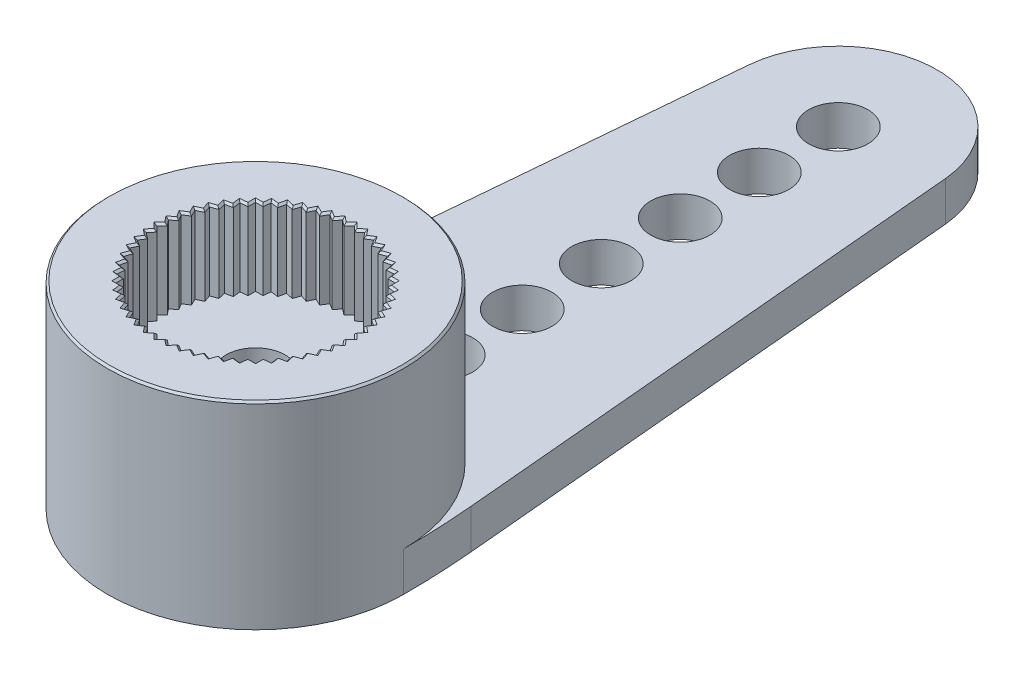
from build123d import *

# Parameters (mm, degrees)
SKETCH1_R           = 0.7500000000000002
SKETCH1_R_2         = 0.7500000000000003
SKETCH1_R_3         = 0.75
BOSS_EXTRUDE1_DEPTH = 1
SKETCH2_R           = 1.5
CUT_EXTRUDE1_DEPTH  = 1
SKETCH2_3_R         = 3.7499999999999964
BOSS_EXTRUDE2_DEPTH = 4
SKETCH1_2_R         = 0.75
CUT_EXTRUDE2_DEPTH  = 19.34734313190876
CUT_EXTRUDE3_START  = -2
SKETCH3_R           = 0.75
CUT_EXTRUDE3_DEPTH  = 2
CHAMFER1_SIZE       = 0.05
CUT_EXTRUDE6_START  = -10
SKETCH4_R           = 0.7500000000000002
SKETCH4_R_2         = 0.7500000000000003
CUT_EXTRUDE6_DEPTH  = 10


with BuildPart() as part:
    # Sketch1 → Boss-Extrude1 (new body)
    with BuildSketch(Plane(origin=(0, 0, 0), x_dir=(1, 0, 0), z_dir=(0, 1, 0))):
        with BuildLine():
            Line((-3.670399020511729, 1.7826112485887735), (-2.4900498775639615, 14.972826406073596))
            ThreePointArc((-2.4900498775639615, 14.972826406073596), (4.44e-15, 17.24999999999999), (2.4900498775639615, 14.972826406073596))
            Line((2.4900498775639615, 14.972826406073596), (3.670399020511729, 1.7826112485887735))
            ThreePointArc((3.670399020511729, 1.7826112485887735), (3.75, 0), (3.670399020511729, -1.7826112485887735))
            Line((3.670399020511729, -1.7826112485887735), (2.4900498775639615, -14.972826406073596))
            ThreePointArc((2.4900498775639615, -14.972826406073596), (4.44e-15, -17.24999999999999), (-2.4900498775639615, -14.972826406073596))
            Line((-2.4900498775639615, -14.972826406073596), (-3.670399020511729, -1.7826112485887735))
            ThreePointArc((-3.670399020511729, -1.7826112485887735), (-3.75, -2.45e-15), (-3.670399020511729, 1.7826112485887735))
        make_face()
        with Locations(Location((5.4e-15, 14.75, 0), (0, 0, 270))):
            Circle(SKETCH1_R, mode=Mode.SUBTRACT)
        with Locations(Location((2.635e-14, 12.75, 0), (0, 0, 270))):
            Circle(SKETCH1_R, mode=Mode.SUBTRACT)
        with Locations(Location((4.73e-14, 10.75, 0), (0, 0, 270))):
            Circle(SKETCH1_R, mode=Mode.SUBTRACT)
        with Locations(Location((6.825e-14, 8.749999999999998, 0), (0, 0, 270))):
            Circle(SKETCH1_R_2, mode=Mode.SUBTRACT)
        with Locations(Location((8.919e-14, 6.749999999999999, 0), (0, 0, 270))):
            Circle(SKETCH1_R, mode=Mode.SUBTRACT)
        with Locations(Location((1.1014e-13, 4.749999999999999, 0), (0, 0, 270))):
            Circle(SKETCH1_R, mode=Mode.SUBTRACT)
        with Locations(Location((-3.06e-15, 0, 0), (0, 0, 270))):
            Circle(SKETCH1_R_3, mode=Mode.SUBTRACT)
        with Locations(Location((1.1014e-13, -4.749999999999999, 0), (0, 0, 90))):
            Circle(SKETCH1_R, mode=Mode.SUBTRACT)
        with Locations(Location((8.919e-14, -6.749999999999999, 0), (0, 0, 90))):
            Circle(SKETCH1_R, mode=Mode.SUBTRACT)
        with Locations(Location((6.825e-14, -8.749999999999998, 0), (0, 0, 90))):
            Circle(SKETCH1_R_2, mode=Mode.SUBTRACT)
        with Locations(Location((4.73e-14, -10.75, 0), (0, 0, 90))):
            Circle(SKETCH1_R, mode=Mode.SUBTRACT)
        with Locations(Location((2.635e-14, -12.75, 0), (0, 0, 90))):
            Circle(SKETCH1_R, mode=Mode.SUBTRACT)
        with Locations(Location((5.4e-15, -14.75, 0), (0, 0, 90))):
            Circle(SKETCH1_R, mode=Mode.SUBTRACT)
    extrude(amount=BOSS_EXTRUDE1_DEPTH)

    # Sketch2 → Cut-Extrude1 (cut)
    with BuildSketch(Plane(origin=(0, 1, 0), x_dir=(1, 0, 0), z_dir=(0, 1, 0))):
        with Locations(Location((0, 0, 0), (0, 0, 270))):
            Circle(SKETCH2_R)
    extrude(amount=-CUT_EXTRUDE1_DEPTH, mode=Mode.SUBTRACT)

    # Sketch2<3> → Boss-Extrude2 (add)
    with BuildSketch(Plane(origin=(0, 1, 0), x_dir=(1, 0, 0), z_dir=(0, 1, 0))):
        with Locations(Location((0, 0, 0), (0, 0, 180))):
            Circle(SKETCH2_3_R)
    extrude(amount=BOSS_EXTRUDE2_DEPTH)

    # Sketch1<2> → Cut-Extrude2 (cut, through all)
    with BuildSketch(Plane(origin=(0, 0, 0), x_dir=(1, 0, 0), z_dir=(0, 1, 0))):
        with Locations(Location((-3.06e-15, 0, 0), (0, 0, 270))):
            Circle(SKETCH1_2_R)
    extrude(amount=CUT_EXTRUDE2_DEPTH, mode=Mode.SUBTRACT)

    # Sketch3 → Cut-Extrude3 (cut)
    with BuildSketch(Plane(origin=(0, 5, 0), x_dir=(1, 0, 0), z_dir=(0, 1, 0)).offset(CUT_EXTRUDE3_START)):
        Polygon((0.13293170414991673, 2.3670682958500833), (0, 2.5), (-0.1329317041499017, 2.3670682958500984), (-0.27991119025823724, 2.48428052473311), (-0.39712341914126226, 2.337301038624758), (-0.5563023348907544, 2.437319780454566), (-0.6563210767205921, 2.278140864705026), (-0.8256976548879083, 2.359708325770875), (-0.9072651159537664, 2.1903317476035395), (-1.0847093477938792, 2.2524221697559907), (-1.1467997699463375, 2.074977937915856), (-1.3300801912883173, 2.11681049807064), (-1.3719127514431064, 1.9335300767286385), (-1.5587245046468003, 1.9545787061699929), (-1.579773134088157, 1.7677669529662765), (-1.7677669529663247, 1.7677669529662765), (-1.7677669529663245, 1.5797731340880863), (-1.9545787061700186, 1.5587245046467322), (-1.9335300767286616, 1.3719127514430158), (-2.1168104980706417, 1.330080191288232), (-2.0749779379158526, 1.14679976994623), (-2.252422169755966, 1.084709347793779), (-2.190331747603507, 0.9072651159536451), (-2.3597083257708227, 0.8256976548877967), (-2.278140864704964, 0.6563210767204612), (-2.4373197804544473, 0.5563023348906617), (-2.337301038624636, 0.39712341914115934), (-2.4842805247329802, 0.2799111902581436), (-2.3670682958499505, 0.1329317041497819), (-2.499999999999859, -1.2601e-13), (-2.367068295849935, -0.1329317041500497), (-2.4842805247329505, -0.27991119025839395), (-2.3373010386245885, -0.3971234191414236), (-2.4373197804543887, -0.556302334890907), (-2.2781408647048855, -0.6563210767207186), (-2.359708325770734, -0.8256976548880337), (-2.1903317476033988, -0.9072651159538916), (-2.2524221697558495, -1.0847093477940046), (-2.0749779379157154, -1.1467997699464625), (-2.1168104980704996, -1.3300801912884428), (-1.9335300767284973, -1.3719127514432319), (-1.954578706169852, -1.5587245046469258), (-1.7677669529661355, -1.5797731340882826), (-1.7677669529661355, -1.7677669529664501), (-1.579773134087945, -1.76776695296645), (-1.558724504646591, -1.9545787061701443), (-1.3719127514428746, -1.933530076728787), (-1.3300801912880909, -2.116810498070767), (-1.1467997699460888, -2.0749779379159774), (-1.0847093477936383, -2.2524221697560907), (-0.9072651159535039, -2.1903317476036324), (-0.8256976548876556, -2.359708325770948), (-0.6563210767203201, -2.2781408647050894), (-0.5563023348905206, -2.4373197804545734), (-0.3971234191410181, -2.3373010386247617), (-0.2799111902580026, -2.484280524733106), (-0.13293170414964117, -2.367068295850076), (2.6702e-13, -2.4999999999999845), (0.13293170415019073, -2.3670682958500606), (0.27991119025853495, -2.484280524733076), (0.3971234191415647, -2.337301038624714), (0.5563023348910479, -2.437319780454514), (0.6563210767208596, -2.2781408647050108), (0.8256976548881746, -2.3597083257708595), (0.9072651159540329, -2.190331747603524), (1.0847093477941459, -2.2524221697559748), (1.1467997699466042, -2.074977937915841), (1.330080191288584, -2.116810498070625), (1.371912751443373, -1.9335300767286228), (1.5587245046470666, -1.9545787061699773), (1.5797731340884236, -1.767766952966261), (1.7677669529665911, -1.767766952966261), (1.767766952966591, -1.5797731340880707), (1.9545787061702853, -1.5587245046467169), (1.9335300767289283, -1.3719127514430003), (2.1168104980709086, -1.3300801912882163), (2.074977937916119, -1.1467997699462147), (2.252422169756232, -1.0847093477937637), (2.190331747603773, -0.9072651159536298), (2.3597083257710887, -0.8256976548877811), (2.2781408647052306, -0.6563210767204459), (2.437319780454714, -0.5563023348906463), (2.337301038624903, -0.39712341914114396), (2.484280524733247, -0.2799111902581283), (2.3670682958502174, -0.13293170414976638), (2.5000000000001252, 1.4132e-13), (2.3670682958502014, 0.132931704150065), (2.484280524733217, 0.2799111902584092), (2.3373010386248554, 0.39712341914143867), (2.437319780454655, 0.5563023348909222), (2.2781408647051524, 0.6563210767207336), (2.3597083257710008, 0.825697654888049), (2.1903317476036657, 0.907265115953907), (2.2524221697561164, 1.08470934779402), (2.074977937915982, 1.146799769946478), (2.1168104980707665, 1.3300801912884581), (1.9335300767287644, 1.371912751443247), (1.9545787061701188, 1.5587245046469411), (1.7677669529664024, 1.579773134088298), (1.7677669529664026, 1.7677669529664655), (1.5797731340882124, 1.7677669529664655), (1.5587245046468583, 1.9545787061701598), (1.3719127514431417, 1.9335300767288028), (1.3300801912883577, 2.116810498070783), (1.146799769946356, 2.074977937915993), (1.0847093477939052, 2.252422169756106), (0.9072651159537498, 2.1903317476036404), (0.8256976548879196, 2.359708325770918), (0.6563210767205938, 2.278140864705065), (0.5563023348907874, 2.437319780454559), (0.3971234191412931, 2.3373010386247532), (0.2799111902582702, 2.4842805247331063), align=None)
        Circle(SKETCH3_R, mode=Mode.SUBTRACT)
    extrude(amount=CUT_EXTRUDE3_DEPTH, mode=Mode.SUBTRACT)

    # Chamfer1
    chamfer1_edges = [part.edges().sort_by_distance(p)[0] for p in [
        (-0.20642144720406946, 5, -2.425674410291604),
        (0.06646585207495836, 5, -2.433534147925042),
        (0.3385173046997816, 5, -2.41079078167893),
        (0.6063117058056906, 5, -2.357730322579812),
        (0.8664813854208349, 5, -2.2750200366872795),
        (1.1157545588701305, 5, -2.16370005383605),
        (1.3509964713657499, 5, -2.025170287399793),
        (1.5692488193675354, 5, -1.8611728295683125),
        (1.7677669529664026, 5, -1.6737700435273817),
        (1.9440543914494417, 5, -1.465318628045094),
        (2.095894217993374, 5, -1.2384399806174682),
        (2.2213769586798913, 5, -0.9959872318739635),
        (2.3189245952380766, 5, -0.7410093658043913),
        (2.3873104095397553, 5, -0.4767128770161805),
        (2.425674410291709, 5, -0.20642144720423716),
        (2.4335341479251715, 5, 0.06646585207481252),
        (2.410790781679075, 5, 0.3385173046996361),
        (2.3577303225799726, 5, 0.606311705805546),
        (2.275020036687431, 5, 0.8664813854207054),
        (2.1637000538361755, 5, 1.1157545588699893),
        (2.0251702873999182, 5, 1.3509964713656082),
        (1.8611728295684382, 5, 1.569248819367394),
        (1.6737700435275074, 5, 1.767766952966261),
        (1.4653186280452197, 5, 1.9440543914493),
        (1.2384399806175943, 5, 2.0958942179932327),
        (0.9959872318740894, 5, 2.2213769586797496),
        (0.741009365804517, 5, 2.3189245952379354),
        (0.47671287701630627, 5, 2.387310409539614),
        (0.2064214472043629, 5, 2.4256744102915686),
        (-0.06646585207468704, 5, 2.4335341479250303),
        (-0.33851730469951036, 5, 2.4107907816789336),
        (-0.6063117058054205, 5, 2.3577303225798314),
        (-0.8664813854205797, 5, 2.27502003668729),
        (-1.1157545588698636, 5, 2.163700053836034),
        (-1.3509964713654827, 5, 2.025170287399777),
        (-1.569248819367268, 5, 1.861172829568297),
        (-1.7677669529661355, 5, 1.6737700435273664),
        (-1.9440543914491748, 5, 1.465318628045079),
        (-2.0958942179931075, 5, 1.2384399806174526),
        (-2.2213769586796244, 5, 0.9959872318739482),
        (-2.3189245952378097, 5, 0.7410093658043762),
        (-2.387310409539489, 5, 0.47671287701616527),
        (-2.4256744102914425, 5, 0.20642144720422184),
        (-2.4335341479249046, 5, -0.06646585207482801),
        (-2.4107907816788083, 5, -0.33851730469965136),
        (-2.3577303225797057, 5, -0.6063117058055616),
        (-2.275020036687165, 5, -0.866481385420721),
        (-2.1637000538359095, 5, -1.1157545588700044),
        (-2.0251702873996518, 5, -1.350996471365624),
        (-1.8611728295681715, 5, -1.5692488193674092),
        (-1.6737700435272407, 5, -1.7677669529662765),
        (-1.4653186280449533, 5, -1.9440543914493156),
        (-1.2384399806173274, 5, -2.095894217993248),
        (-0.9959872318738228, 5, -2.221376958679765),
        (-0.74100936580425, 5, -2.3189245952379505),
        (-0.47671287701600834, 5, -2.387310409539662),
        (-0.3385173046997497, 5, -2.410790781678934),
        (-0.6063117058056733, 5, -2.357730322579796),
        (-0.8664813854208373, 5, -2.2750200366872075),
        (-1.1157545588701083, 5, -2.1637000538359237),
        (-1.3509964713657119, 5, -2.0251702873996393),
        (-1.5692488193674787, 5, -1.8611728295681347),
        (-1.7677669529663245, 5, -1.6737700435271814),
        (-1.94405439144934, 5, -1.465318628044874),
        (-2.095894217993247, 5, -1.238439980617231),
        (-2.2213769586797367, 5, -0.9959872318737121),
        (-2.3189245952378936, 5, -0.741009365804129),
        (-2.3873104095395417, 5, -0.47671287701591053),
        (-2.4256744102914656, 5, -0.20642144720396274),
        (-2.433534147924897, 5, 0.06646585207508786),
        (-2.4107907816787693, 5, 0.33851730469990876),
        (-2.357730322579637, 5, 0.6063117058058127),
        (-2.2750200366870663, 5, 0.8664813854209626),
        (-2.1637000538357825, 5, 1.1157545588702336),
        (-2.0251702873994986, 5, 1.3509964713658373),
        (-1.8611728295679937, 5, 1.5692488193676042),
        (-1.6737700435270404, 5, 1.7677669529664501),
        (-1.4653186280447328, 5, 1.9440543914494657),
        (-1.2384399806170898, 5, 2.095894217993372),
        (-0.9959872318735711, 5, 2.2213769586798615),
        (-0.7410093658039878, 5, 2.318924595238019),
        (-0.47671287701576937, 5, 2.3873104095396678),
        (-0.20642144720382188, 5, 2.425674410291591),
        (0.06646585207522888, 5, 2.4335341479250223),
        (0.3385173047000498, 5, 2.4107907816788954),
        (0.6063117058059537, 5, 2.357730322579762),
        (0.8664813854211038, 5, 2.2750200366871915),
        (1.115754558870375, 5, 2.1637000538359077),
        (1.3509964713659786, 5, 2.025170287399624),
        (1.5692488193677452, 5, 1.8611728295681191),
        (1.767766952966591, 5, 1.6737700435271659),
        (1.944054391449607, 5, 1.4653186280448587),
        (2.095894217993514, 5, 1.2384399806172155),
        (2.2213769586800023, 5, 0.9959872318736968),
        (2.3189245952381596, 5, 0.7410093658041135),
        (2.3873104095398086, 5, 0.47671287701589515),
        (2.4256744102917325, 5, 0.20642144720394734),
        (2.4335341479251635, 5, -0.06646585207510317),
        (2.410790781679036, 5, -0.3385173046999239),
        (2.357730322579904, 5, -0.6063117058058278),
        (2.275020036687333, 5, -0.8664813854209781),
        (2.163700053836049, 5, -1.115754558870249),
        (2.0251702873997655, 5, -1.3509964713658524),
        (1.8611728295682606, 5, -1.5692488193676195),
        (1.6737700435273075, 5, -1.7677669529664655),
        (1.465318628045, 5, -1.9440543914494812),
        (1.2384399806173567, 5, -2.095894217993388),
        (0.9959872318738274, 5, -2.221376958679873),
        (0.7410093658042567, 5, -2.3189245952379913),
        (0.47671287701604026, 5, -2.3873104095396562),
        (0.2064214472040934, 5, -2.425674410291595),
        (-0.06646585207495086, 5, -2.433534147925049),
        (3.7499999999999964, 5, 9.2e-16),
    ]]
    chamfer(chamfer1_edges, length=CHAMFER1_SIZE)

    # Sketch4 → Cut-Extrude6 (cut)
    with BuildSketch(Plane(origin=(0, 1, 0), x_dir=(1, 0, 0), z_dir=(0, 1, 0)).offset(CUT_EXTRUDE6_START)):
        with BuildLine():
            ThreePointArc((3.670399020511729, -1.7826112485887735), (3.7300898447709017, -0.8921938101571203), (3.7499999999999964, 0))
            ThreePointArc((3.7499999999999964, 0), (2.3e-16, -3.7499999999999964), (-3.7499999999999964, 0))
            ThreePointArc((-3.7499999999999964, 0), (-3.730089844770898, -0.8921938101571197), (-3.670399020511729, -1.7826112485887813))
            Line((-3.670399020511729, -1.7826112485887813), (-2.4900498775639615, -14.972826406073596))
            ThreePointArc((-2.4900498775639615, -14.972826406073596), (5e-15, -17.25), (2.490049877563967, -14.972826406073596))
            Line((2.490049877563967, -14.972826406073596), (3.670399020511729, -1.7826112485887735))
        make_face()
        with Locations((2.635e-14, -12.75)):
            Circle(SKETCH4_R, mode=Mode.SUBTRACT)
        with Locations((1.1014e-13, -4.749999999999999)):
            Circle(SKETCH4_R, mode=Mode.SUBTRACT)
        with Locations((4.73e-14, -10.75)):
            Circle(SKETCH4_R, mode=Mode.SUBTRACT)
        with Locations((5.4e-15, -14.75)):
            Circle(SKETCH4_R, mode=Mode.SUBTRACT)
        with Locations((8.919e-14, -6.749999999999999)):
            Circle(SKETCH4_R, mode=Mode.SUBTRACT)
        with Locations((6.825e-14, -8.749999999999998)):
            Circle(SKETCH4_R_2, mode=Mode.SUBTRACT)
    extrude(amount=CUT_EXTRUDE6_DEPTH, mode=Mode.SUBTRACT)


solid = part.part
